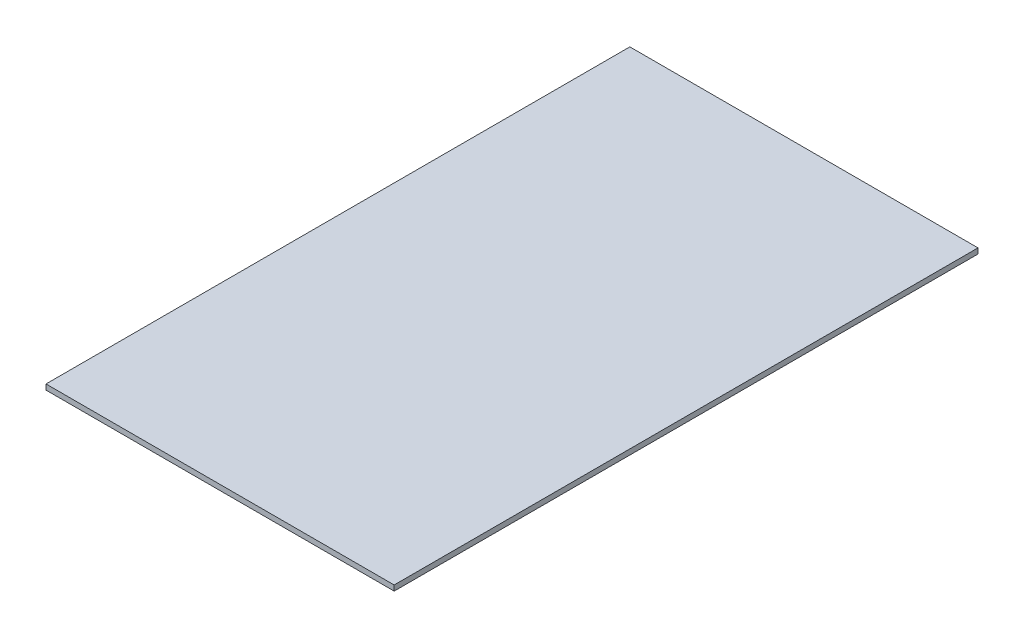
from build123d import *

# Parameters (mm, degrees)
SKETCH1_W           = 130
SKETCH1_H           = 218
BOSS_EXTRUDE1_DEPTH = 1


with BuildPart() as part:
    # Sketch1 → Boss-Extrude1 (new, symmetric)
    with BuildSketch(Plane(origin=(0, 0, 0), x_dir=(1, 0, 0), z_dir=(0, 1, 0))):
        Rectangle(SKETCH1_W, SKETCH1_H)
    extrude(amount=BOSS_EXTRUDE1_DEPTH, both=True)


solid = part.part
